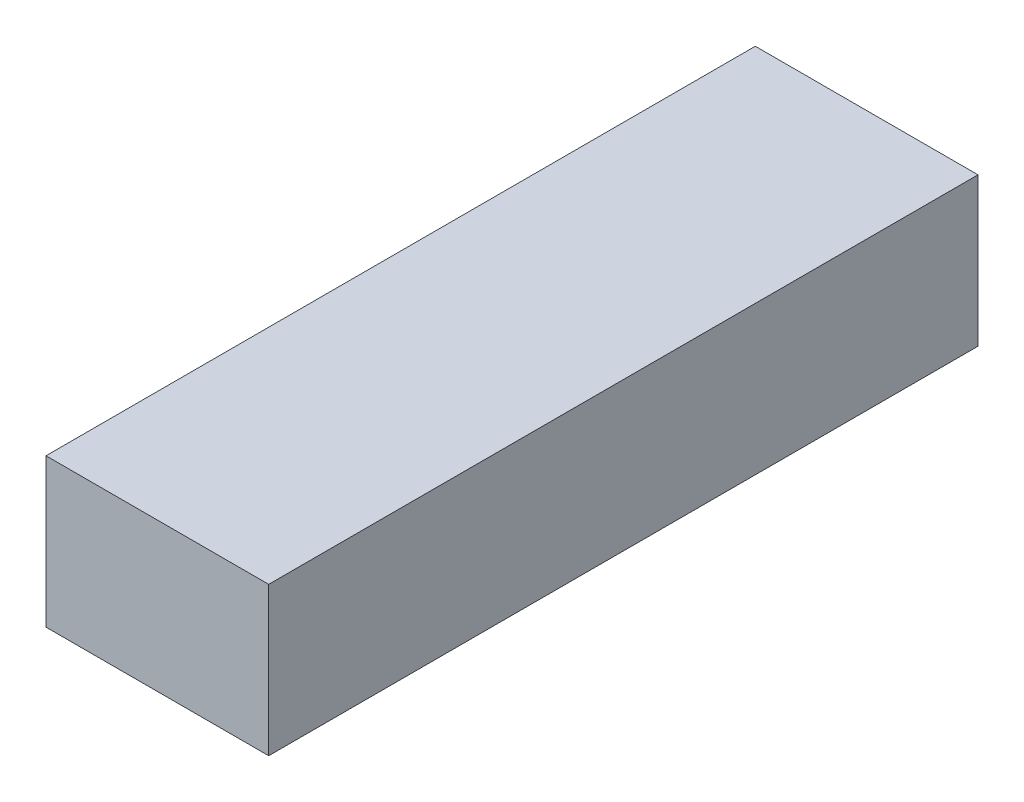
from build123d import *

# Parameters (mm, degrees)
SKETCH1_W           = 42.8625
SKETCH1_H           = 28.575
BOSS_EXTRUDE1_DEPTH = 68.2625


with BuildPart() as part:
    # Sketch1 → Boss-Extrude1 (new, symmetric)
    with BuildSketch(Plane.XY):
        Rectangle(SKETCH1_W, SKETCH1_H)
    extrude(amount=BOSS_EXTRUDE1_DEPTH, both=True)


solid = part.part
